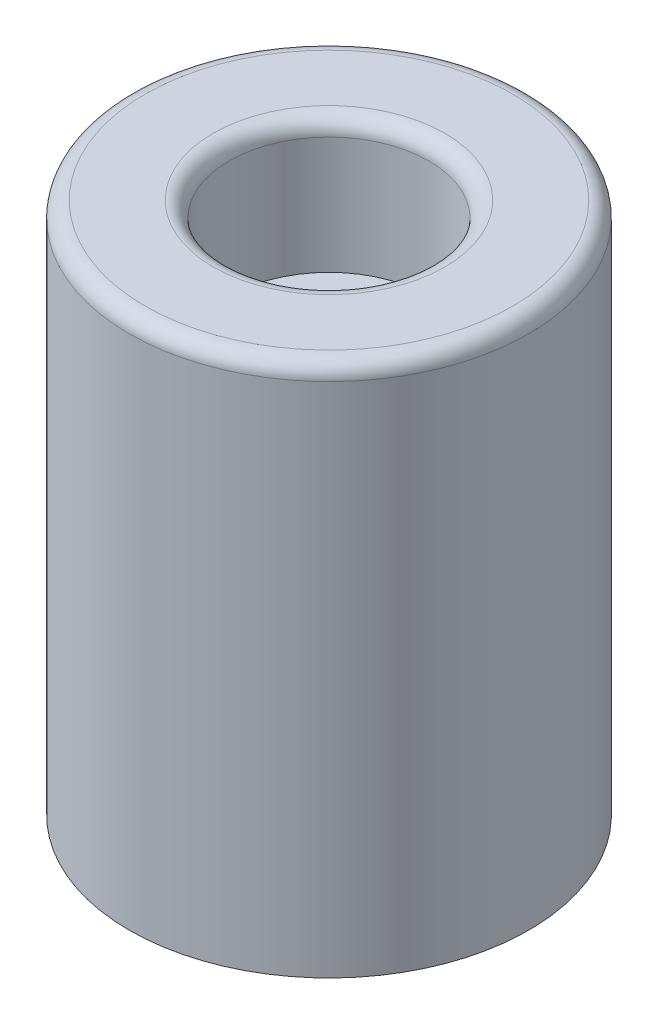
from build123d import *

# Parameters (mm, degrees)
SKETCH1_R           = 9.525
BOSS_EXTRUDE1_DEPTH = 25.4
SKETCH2_R           = 4.7625
CUT_EXTRUDE1_DEPTH  = 6.35
SKETCH3_R           = 1.984375
CUT_EXTRUDE2_DEPTH  = 24.3313898
FILLET1_R           = 0.762


with BuildPart() as part:
    # Sketch1 → Boss-Extrude1 (new body)
    with BuildSketch(Plane(origin=(0, 0, 0), x_dir=(1, 0, 0), z_dir=(0, 1, 0))):
        with Locations(Location((0, 0, 0), (0, 0, 270))):
            Circle(SKETCH1_R)
    extrude(amount=BOSS_EXTRUDE1_DEPTH)

    # Sketch2 → Cut-Extrude1 (cut)
    with BuildSketch(Plane(origin=(0, 25.4, 0), x_dir=(1, 0, 0), z_dir=(0, 1, 0))):
        with Locations(Location((0, 0, 0), (0, 0, 270))):
            Circle(SKETCH2_R)
    extrude(amount=-CUT_EXTRUDE1_DEPTH, mode=Mode.SUBTRACT)

    # Sketch3 → Cut-Extrude2 (cut, through all)
    with BuildSketch(Plane(origin=(0, 19.05, 0), x_dir=(1, 0, 0), z_dir=(0, 1, 0))):
        with Locations(Location((0, 0, 0), (0, 0, 270))):
            Circle(SKETCH3_R)
    extrude(amount=-CUT_EXTRUDE2_DEPTH, mode=Mode.SUBTRACT)

    # Fillet1
    fillet1_edges = [part.edges().sort_by_distance(p)[0] for p in [
        (0, 25.4, -9.525),
        (0, 25.4, -4.7625),
    ]]
    fillet(fillet1_edges, radius=FILLET1_R)


solid = part.part
